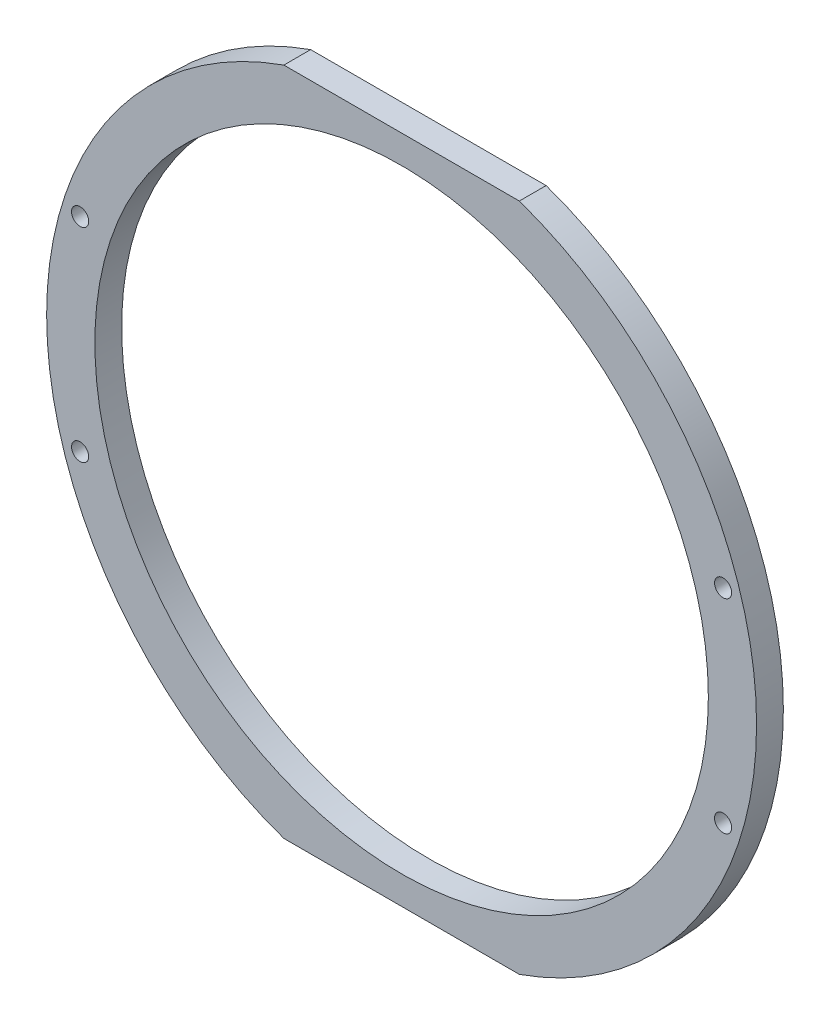
from build123d import *

# Parameters (mm, degrees)
ESQUISSE2_R        = 1.6
ESQUISSE2_R_2      = 57.25
BOSS_EXTRU_2_DEPTH = 5


with BuildPart() as part:
    # Esquisse2 → Boss.-Extru.2 (new body)
    with BuildSketch(Plane.XY):
        with BuildLine():
            Line((-21.972994789, 62.5), (21.972994789, 62.5))
            ThreePointArc((21.972994789, 62.5), (66.25, 0), (21.972994789, -62.5))
            Line((21.972994789, -62.5), (-21.972994789, -62.5))
            ThreePointArc((-21.972994789, -62.5), (-66.25, 0), (-21.972994789, 62.5))
        make_face()
        with Locations((60, 19)):
            Circle(ESQUISSE2_R, mode=Mode.SUBTRACT)
        with Locations((60, -19)):
            Circle(ESQUISSE2_R, mode=Mode.SUBTRACT)
        with Locations((-60, -19)):
            Circle(ESQUISSE2_R, mode=Mode.SUBTRACT)
        with Locations((-60, 19)):
            Circle(ESQUISSE2_R, mode=Mode.SUBTRACT)
        Circle(ESQUISSE2_R_2, mode=Mode.SUBTRACT)
    extrude(amount=BOSS_EXTRU_2_DEPTH)


solid = part.part
